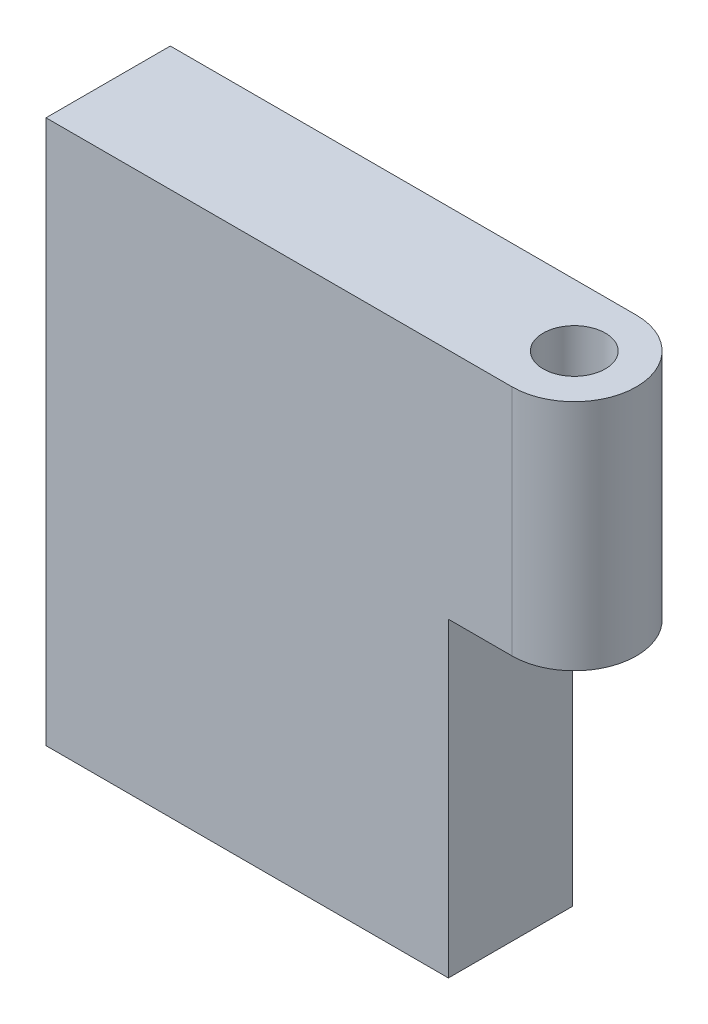
from build123d import *

# Parameters (mm, degrees)
BOSS_EXTRUDE1_DEPTH = 15
SKETCH2_R           = 2
CUT_EXTRUDE1_DEPTH  = 34.778691508
SKETCH3_W           = 25.9
SKETCH3_H           = 8
BOSS_EXTRUDE2_DEPTH = 20


with BuildPart() as part:
    # Sketch1 → Boss-Extrude1 (new body)
    with BuildSketch(Plane(origin=(0, 0, 0), x_dir=(1, 0, 0), z_dir=(0, 1, 0))):
        with BuildLine():
            Line((-30, -4), (0, -4))
            ThreePointArc((0, -4), (-4, 0), (0, 4))
            Line((0, 4), (-30, 4))
            Line((-30, 4), (-30, -4))
        make_face()
        with BuildLine():
            ThreePointArc((0, 4), (-4, 0), (0, -4))
            Line((0, -4), (0, 4))
        make_face()
        with BuildLine():
            Line((0, 4), (0, -4))
            ThreePointArc((0, -4), (2.828427125, -2.828427125), (4, 0))
            ThreePointArc((4, 0), (2.828427125, 2.828427125), (0, 4))
        make_face()
    extrude(amount=BOSS_EXTRUDE1_DEPTH)

    # Sketch2 → Cut-Extrude1 (cut, through all)
    with BuildSketch(Plane(origin=(0, 15, 0), x_dir=(1, 0, 0), z_dir=(0, 1, 0))):
        with Locations(Location((0, 0, 0), (0, 0, 270))):
            Circle(SKETCH2_R)
    extrude(amount=-CUT_EXTRUDE1_DEPTH, mode=Mode.SUBTRACT)

    # Sketch3 → Boss-Extrude2 (add)
    with BuildSketch(Plane.XZ):
        with Locations((-17.05, 0)):
            Rectangle(SKETCH3_W, SKETCH3_H)
    extrude(amount=BOSS_EXTRUDE2_DEPTH)


solid = part.part
